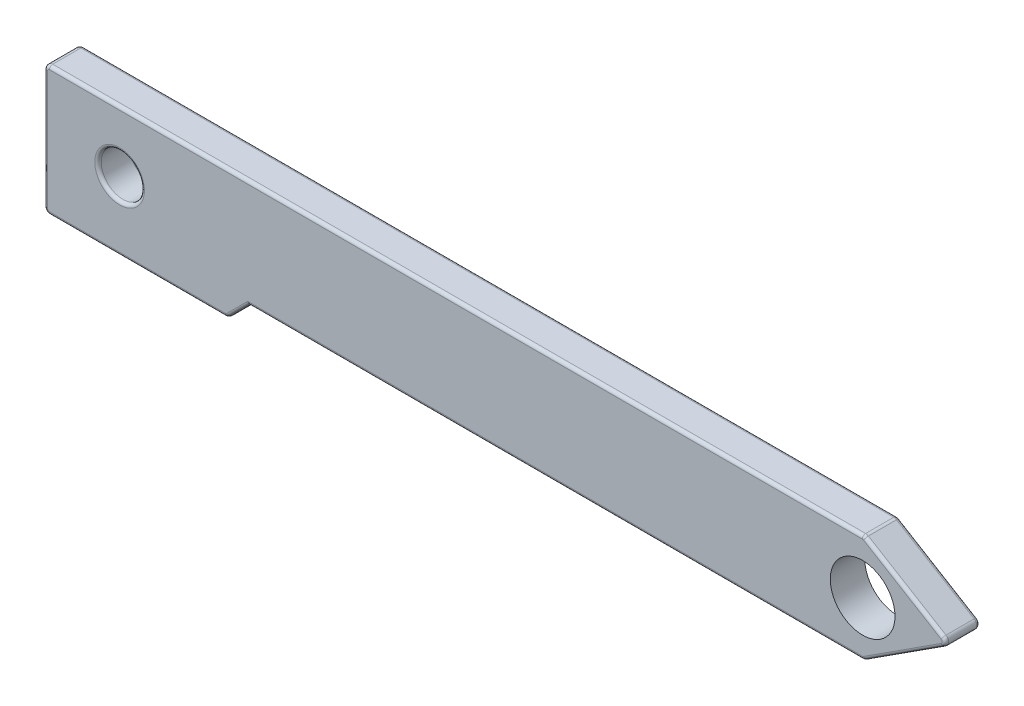
from build123d import *

# Parameters (mm, degrees)
SKETCH1_R           = 1
BOSS_EXTRUDE1_DEPTH = 1.6
FILLET1_R           = 0.15
SKETCH2_R           = 1.5
CUT_EXTRUDE1_DEPTH  = 26.118429106
FILLET2_R           = 0.15
CUT_EXTRUDE2_DEPTH  = 0.5
FILLET3_R           = 0.1
FILLET4_R           = 0.15


with BuildPart() as part:
    # Sketch1 → Boss-Extrude1 (new body)
    with BuildSketch(Plane.XY):
        with BuildLine():
            Line((20.711831818, 0), (-7.714550435, 0))
            Line((-7.714550435, 0), (-8.64132713, -0.926776695))
            ThreePointArc((-8.64132713, -0.926776695), (-8.722432968, -0.980969883), (-8.818103826, -1))
            Line((-8.818103826, -1), (-16.964550435, -1))
            ThreePointArc((-16.964550435, -1), (-17.14132713, -0.926776695), (-17.214550435, -0.75))
            Line((-17.214550435, -0.75), (-17.214550435, 4.75))
            ThreePointArc((-17.214550435, 4.75), (-17.14132713, 4.926776695), (-16.964550435, 5))
            Line((-16.964550435, 5), (20.715695772, 5))
            ThreePointArc((20.715695772, 5), (20.782883317, 4.990802479), (20.845127191, 4.96388667))
            Line((20.845127191, 4.96388667), (24.443133824, 2.786588264))
            ThreePointArc((24.443133824, 2.786588264), (24.56367691, 2.576271817), (24.449189394, 2.362598581))
            Line((24.449189394, 2.362598581), (20.847318807, 0.039896988))
            ThreePointArc((20.847318807, 0.039896988), (20.782451386, 0.010181576), (20.711831818, 0))
        make_face()
        with Locations((-13.714550435, 2.2)):
            Circle(SKETCH1_R, mode=Mode.SUBTRACT)
    extrude(amount=BOSS_EXTRUDE1_DEPTH)

    # Fillet1
    fillet1_edges = [part.edges().sort_by_distance(p)[0] for p in [
        (20.782451386, 0.010181576, 1.6),
        (-8.722432968, -0.980969883, 0),
        (-12.89132713, -1, 0),
        (-17.14132713, -0.926776695, 0),
        (-17.214550435, 2, 0),
        (-17.14132713, 4.926776695, 0),
        (1.875572668, 5, 0),
        (20.782883317, 4.990802479, 0),
        (22.644130508, 3.875237467, 0),
        (24.56367691, 2.576271817, 0),
        (22.6482541, 1.201247785, 0),
        (22.6482541, 1.201247785, 1.6),
        (20.782451386, 0.010181576, 0),
        (6.498640691, 0, 0),
        (-8.177938783, -0.463388348, 0),
        (24.56367691, 2.576271817, 1.6),
        (22.644130508, 3.875237467, 1.6),
        (20.782883317, 4.990802479, 1.6),
        (1.875572668, 5, 1.6),
        (-17.14132713, 4.926776695, 1.6),
        (-17.214550435, 2, 1.6),
        (-17.14132713, -0.926776695, 1.6),
        (-12.89132713, -1, 1.6),
        (-8.177938783, -0.463388348, 1.6),
        (-8.722432968, -0.980969883, 1.6),
        (6.498640691, 0, 1.6),
    ]]
    fillet(fillet1_edges, radius=FILLET1_R)

    # Sketch2 → Cut-Extrude1 (cut, through all)
    with BuildSketch(Plane.XY.offset(1.6)):
        with Locations((20.727351555, 2.5)):
            Circle(SKETCH2_R)
    extrude(amount=-CUT_EXTRUDE1_DEPTH, mode=Mode.SUBTRACT)

    # Fillet2
    fillet2_edges = [part.edges().sort_by_distance(p)[0] for p in [
        (-14.714550435, 2.2, 0),
        (-14.714550435, 2.2, 1.6),
    ]]
    fillet(fillet2_edges, radius=FILLET2_R)

    # Sketch3 → Cut-Extrude2 (cut)
    with BuildSketch(Plane(origin=(0, 0, 0), x_dir=(-1, 0, 0), z_dir=(0, 0, -1))):
        with BuildLine():
            Line((-10.767468339, 4.35), (1.232531661, 4.35))
            ThreePointArc((1.232531661, 4.35), (-4.767468339, 3.428784028), (-10.767468339, 4.35))
        make_face()
    extrude(amount=-CUT_EXTRUDE2_DEPTH, mode=Mode.SUBTRACT)

    # Fillet3
    fillet3_edges = [part.edges().sort_by_distance(p)[0] for p in [
        (-1.232531661, 4.35, 0.25),
        (10.767468339, 4.35, 0.25),
    ]]
    fillet(fillet3_edges, radius=FILLET3_R)

    # Fillet4
    fillet4_edges = [part.edges().sort_by_distance(p)[0] for p in [
        (4.767468339, 3.428784028, 0),
        (4.767468339, 4.35, 0),
        (10.17544157, 4.263461428, 0),
        (-0.640504891, 4.263461428, 0),
    ]]
    fillet(fillet4_edges, radius=FILLET4_R)


solid = part.part
